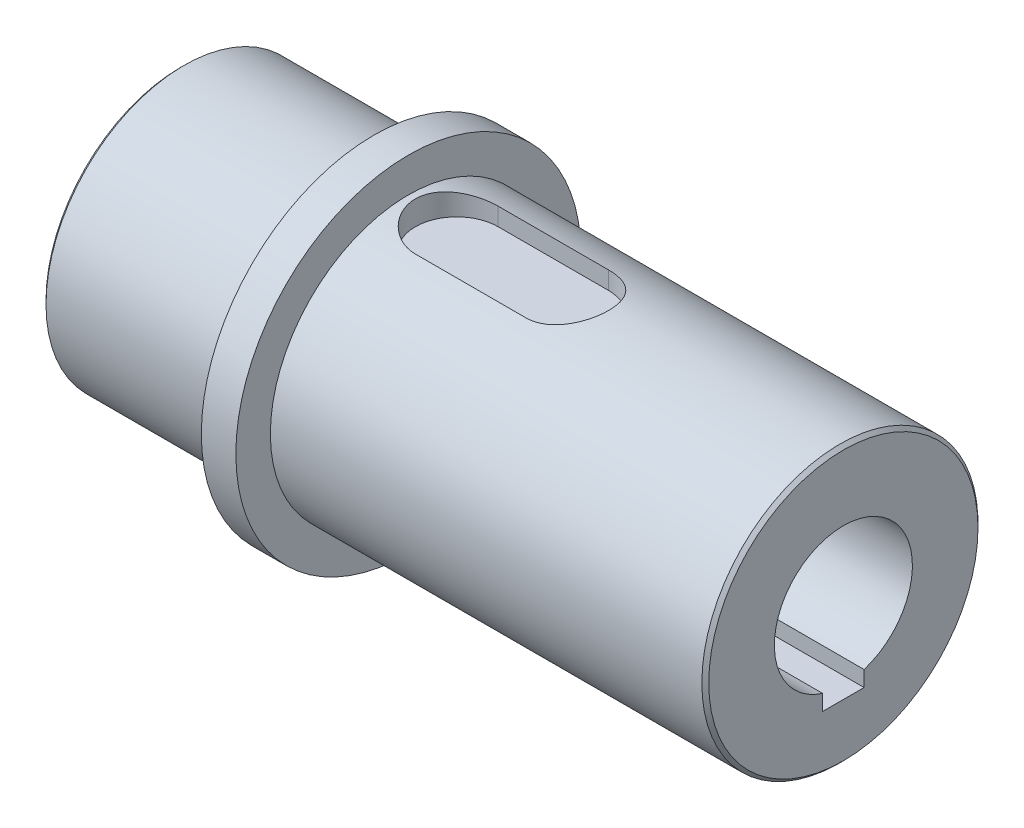
from build123d import *

# Parameters (mm, degrees)
CUT_EXTRUDE1_DEPTH = 3.5
SKETCH3_R          = 10
CUT_EXTRUDE2_DEPTH = 103.303470127
SKETCH4_W          = 6
SKETCH4_H          = 3.081008582
CUT_EXTRUDE3_DEPTH = 103.303470127


with BuildPart() as part:
    # Sketch1 → Revolve1 (revolve)
    with BuildSketch(Plane(origin=(0, 0, 0), x_dir=(1, 0, 0), z_dir=(0, 1, 0)), mode=Mode.PRIVATE) as revolve1_sk:
        Polygon((96, 0), (96, 19.5), (95.5, 20), (33, 20), (33, 25), (28, 25), (28, 20), (0.5, 20), (0, 19.5), (0, 0), align=None)
    revolve(revolve1_sk.sketch.rotate(Axis((0, 0, 0), (1, 0, 0)), 180), axis=Axis((0, 0, 0), (1, 0, 0)))

    # Sketch2 → Cut-Extrude1 (cut)
    with BuildSketch(Plane(origin=(0, 20, 0), x_dir=(1, 0, 0), z_dir=(0, 1, 0))):
        with BuildLine():
            Line((40, 6), (56, 6))
            ThreePointArc((56, 6), (62, 0), (56, -6))
            Line((56, -6), (40, -6))
            ThreePointArc((40, -6), (34, 0), (40, 6))
        make_face()
    extrude(amount=-CUT_EXTRUDE1_DEPTH, mode=Mode.SUBTRACT)

    # Sketch3 → Cut-Extrude2 (cut, through all)
    with BuildSketch(Plane.ZY):
        Circle(SKETCH3_R)
    extrude(amount=-CUT_EXTRUDE2_DEPTH, mode=Mode.SUBTRACT)

    # Sketch4 → Cut-Extrude3 (cut, through all)
    with BuildSketch(Plane.ZY):
        with Locations((0, -10.259495709)):
            Rectangle(SKETCH4_W, SKETCH4_H)
    extrude(amount=-CUT_EXTRUDE3_DEPTH, mode=Mode.SUBTRACT)


solid = part.part
